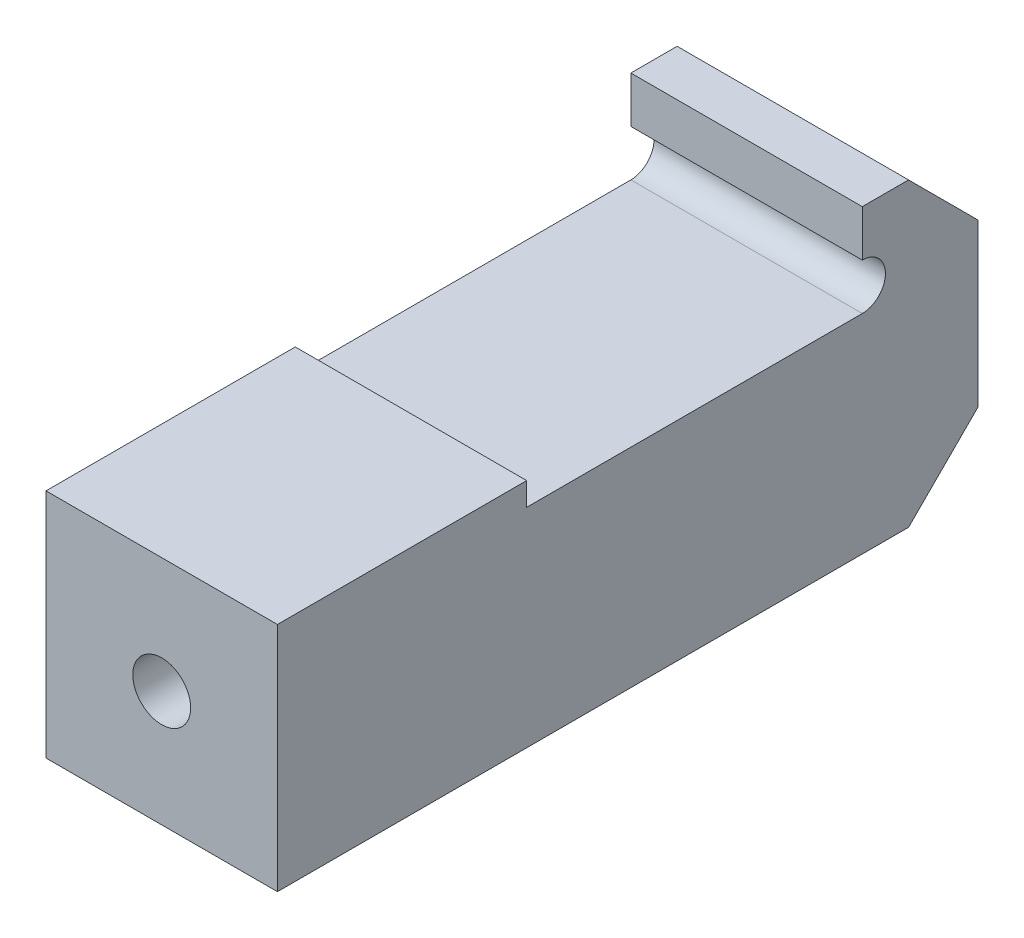
from build123d import *

# Parameters (mm, degrees)
BOSS_EXTRUDE1_DEPTH       = 10
CHAMFER1_SIZE             = 3
M3X0_5_TAPPED_HOLE1_D     = 2.5
M3X0_5_TAPPED_HOLE1_DEPTH = 14.5
M3X0_5_TAPPED_HOLE1_TIP   = 0.751075774


with BuildPart() as part:
    # Sketch1 → Boss-Extrude1 (new body)
    with BuildSketch(Plane(origin=(0, 0, 0), x_dir=(0, 0, -1), z_dir=(1, 0, 0))):
        with BuildLine():
            Line((0, 1), (0, 3))
            Line((0, 3), (5, 3))
            Line((5, 3), (5, -10))
            Line((5, -10), (-25.27, -10))
            Line((-25.27, -10), (-25.27, 0))
            Line((-25.27, 0), (-14.5, 0))
            Line((-14.5, 0), (-14.5, -1))
            Line((-14.5, -1), (0, -1))
            ThreePointArc((0, -1), (1, 0), (0, 1))
        make_face()
    extrude(amount=-BOSS_EXTRUDE1_DEPTH)

    # Chamfer1
    chamfer1_edges = [part.edges().sort_by_distance(p)[0] for p in [
        (-5, 3, -5),
        (-5, -10, -5),
    ]]
    chamfer(chamfer1_edges, length=CHAMFER1_SIZE)

    # M3x0.5 Tapped Hole1
    with Locations(Plane(origin=(-5, -5, 25.27), x_dir=(1, 0, 0), z_dir=(0, 0, 1))):
        with Locations((0, 0)):
            Hole(M3X0_5_TAPPED_HOLE1_D / 2, depth=M3X0_5_TAPPED_HOLE1_DEPTH)
            with Locations((0, 0, -(M3X0_5_TAPPED_HOLE1_DEPTH + M3X0_5_TAPPED_HOLE1_TIP / 2))):  # 118° drill point
                Cone(0, M3X0_5_TAPPED_HOLE1_D / 2, M3X0_5_TAPPED_HOLE1_TIP, mode=Mode.SUBTRACT)


solid = part.part
